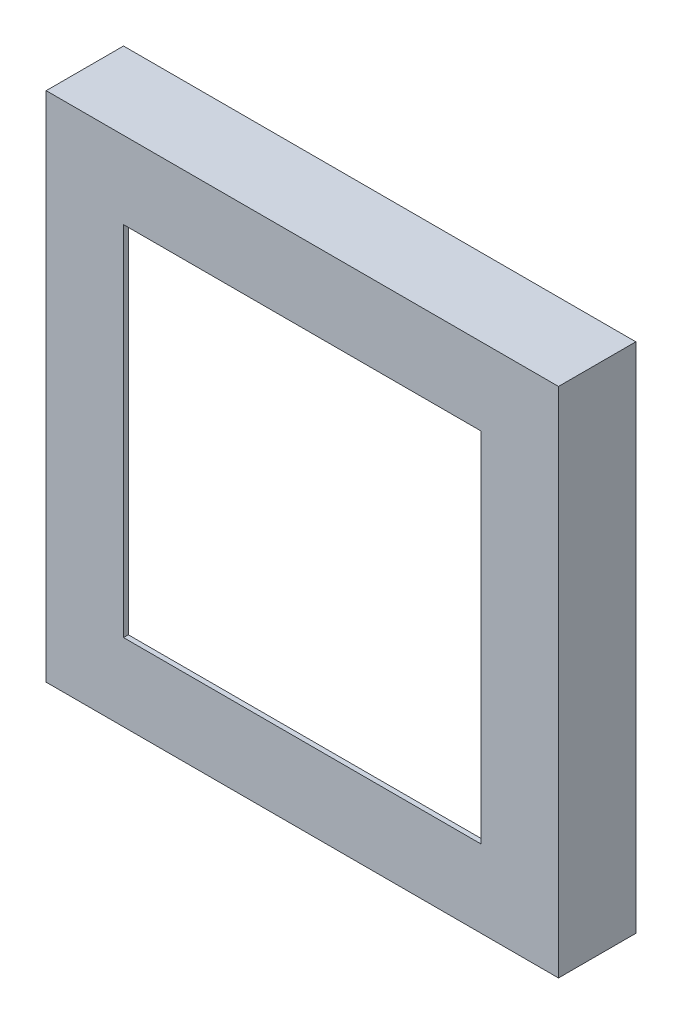
from build123d import *

# Parameters (mm, degrees)
SKETCH1_W           = 106
SKETCH1_H           = 106
SKETCH1_W_2         = 104
SKETCH1_H_2         = 104
BOSS_EXTRUDE1_DEPTH = 15
SKETCH2_W           = 106
SKETCH2_H           = 106
SKETCH2_W_2         = 74
SKETCH2_H_2         = 74
BOSS_EXTRUDE2_DEPTH = 1


with BuildPart() as part:
    # Sketch1 → Boss-Extrude1 (new body)
    with BuildSketch(Plane.XY):
        with Locations((52, 52)):
            Rectangle(SKETCH1_W, SKETCH1_H)
        with Locations((52, 52)):
            Rectangle(SKETCH1_W_2, SKETCH1_H_2, mode=Mode.SUBTRACT)
    extrude(amount=BOSS_EXTRUDE1_DEPTH)

    # Sketch2 → Boss-Extrude2 (add)
    with BuildSketch(Plane.XY.offset(15)):
        with Locations((52, 52)):
            Rectangle(SKETCH2_W, SKETCH2_H)
        with Locations((52, 52)):
            Rectangle(SKETCH2_W_2, SKETCH2_H_2, mode=Mode.SUBTRACT)
    extrude(amount=BOSS_EXTRUDE2_DEPTH)


solid = part.part
